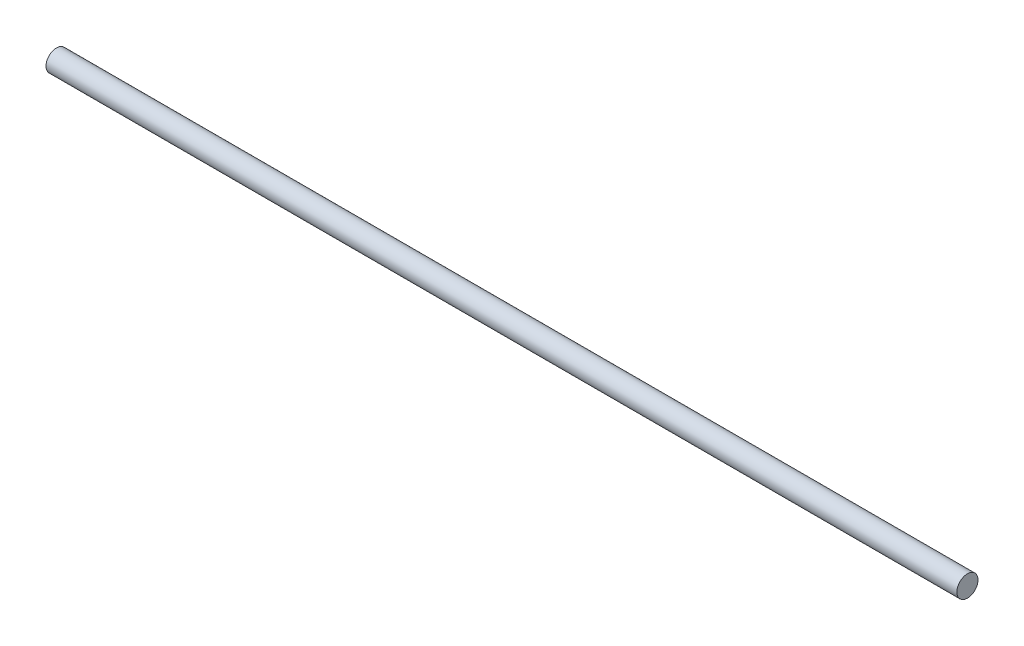
from build123d import *

# Parameters (mm, degrees)
SKETCH1_R           = 5
BOSS_EXTRUDE1_DEPTH = 215.5


with BuildPart() as part:
    # Sketch1 → Boss-Extrude1 (new, symmetric)
    with BuildSketch(Plane(origin=(0, 0, 0), x_dir=(0, 0, -1), z_dir=(1, 0, 0))):
        Circle(SKETCH1_R)
    extrude(amount=BOSS_EXTRUDE1_DEPTH, both=True)


solid = part.part
